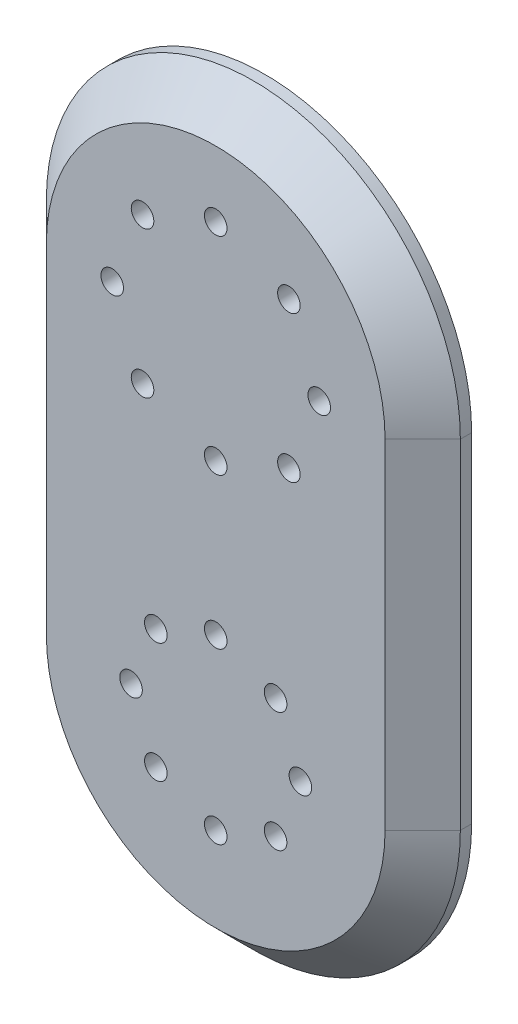
from build123d import *

# Parameters (mm, degrees)
EXTRUDE_1_DEPTH     = 13
CHAMFER_1_SIZE      = 10
SKETCH_2_R          = 23.5
CUT_EXTRUDE_1_DEPTH = 10
CUT_EXTRUDE_2_DEPTH = 7
SKETCH_3_R          = 3
CUT_EXTRUDE_3_DEPTH = 115.865138314


with BuildPart() as part:
    # 草图1 → 凸台-拉伸1 (new body)
    with BuildSketch(Plane.XY):
        with BuildLine():
            Line((-55, -45), (-55, 45))
            ThreePointArc((-55, 45), (0, 100), (55, 45))
            Line((55, 45), (55, -45))
            ThreePointArc((55, -45), (0, -100), (-55, -45))
        make_face()
    extrude(amount=EXTRUDE_1_DEPTH)

    # 倒角1
    chamfer_1_edges = [part.edges().sort_by_distance(p)[0] for p in [
        (0, -100, 13),
        (55, 0, 13),
        (-55, 0, 13),
        (0, 100, 13),
    ]]
    chamfer(chamfer_1_edges, length=CHAMFER_1_SIZE)

    # 草图2 → 切除-拉伸1 (cut)
    with BuildSketch(Plane(origin=(0, 0, 0), x_dir=(-1, 0, 0), z_dir=(0, 0, -1))):
        with Locations((0, 45)):
            Circle(SKETCH_2_R)
    extrude(amount=-CUT_EXTRUDE_1_DEPTH, mode=Mode.SUBTRACT)

    # 草图2<4> → 切除-拉伸2 (cut)
    with BuildSketch(Plane(origin=(0, 0, 0), x_dir=(-1, 0, 0), z_dir=(0, 0, -1))):
        with BuildLine():
            Line((-31, -45), (-31, -15))
            ThreePointArc((-31, -15), (-28.071067812, -7.928932188), (-21, -5))
            Line((-21, -5), (21, -5))
            ThreePointArc((21, -5), (28.071067812, -7.928932188), (31, -15))
            Line((31, -15), (31, -45))
            ThreePointArc((31, -45), (0, -76), (-31, -45))
        make_face()
    extrude(amount=-CUT_EXTRUDE_2_DEPTH, mode=Mode.SUBTRACT)

    # 草图3 → 切除-拉伸3 (cut, through all)
    with BuildSketch(Plane(origin=(0, 0, 0), x_dir=(-1, 0, 0), z_dir=(0, 0, -1))):
        with Locations((0, 72.5)):
            Circle(SKETCH_3_R)
        with Locations((19.445436483, 64.445436483)):
            Circle(SKETCH_3_R)
        with Locations((27.5, 45)):
            Circle(SKETCH_3_R)
        with Locations((19.445436483, 25.554563517)):
            Circle(SKETCH_3_R)
        with Locations((0, 17.5)):
            Circle(SKETCH_3_R)
        with Locations((-19.445436483, 25.554563517)):
            Circle(SKETCH_3_R)
        with Locations((-27.5, 45)):
            Circle(SKETCH_3_R)
        with Locations((-19.445436483, 64.445436483)):
            Circle(SKETCH_3_R)
        with Locations((0, -22.5)):
            Circle(SKETCH_3_R)
        with Locations((15.909902577, -29.090097423)):
            Circle(SKETCH_3_R)
        with Locations((22.5, -45)):
            Circle(SKETCH_3_R)
        with Locations((15.909902577, -60.909902577)):
            Circle(SKETCH_3_R)
        with Locations((0, -67.5)):
            Circle(SKETCH_3_R)
        with Locations((-15.909902577, -60.909902577)):
            Circle(SKETCH_3_R)
        with Locations((-22.5, -45)):
            Circle(SKETCH_3_R)
        with Locations((-15.909902577, -29.090097423)):
            Circle(SKETCH_3_R)
    extrude(amount=-CUT_EXTRUDE_3_DEPTH, mode=Mode.SUBTRACT)


solid = part.part
